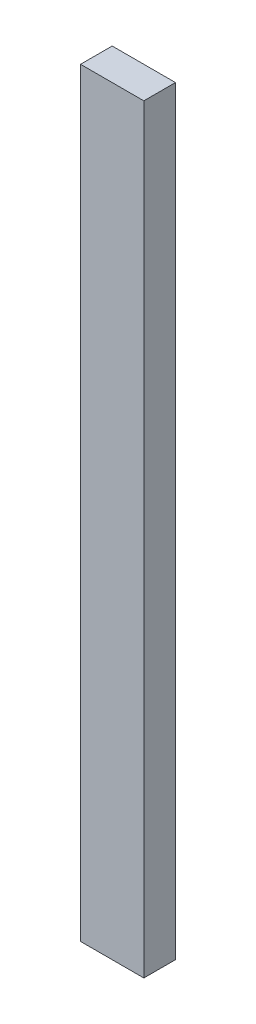
from build123d import *

# Parameters (mm, degrees)
SKETCH1_W           = 6.35
SKETCH1_H           = 76.2
BOSS_EXTRUDE1_DEPTH = 3.175
SKETCH1_3_W         = 6.35
SKETCH1_3_H         = 76.2
BOSS_EXTRUDE2_DEPTH = 3.175


with BuildPart() as part:
    # Sketch1 → Boss-Extrude1 (new body)
    with BuildSketch(Plane.XY):
        with Locations((3.175, 38.1)):
            Rectangle(SKETCH1_W, SKETCH1_H)
    extrude(amount=BOSS_EXTRUDE1_DEPTH)

    # Sketch1<3> → Boss-Extrude2 (add)
    with BuildSketch(Plane.XY):
        with Locations((3.175, 38.1)):
            Rectangle(SKETCH1_3_W, SKETCH1_3_H)
    extrude(amount=BOSS_EXTRUDE2_DEPTH)


solid = part.part
